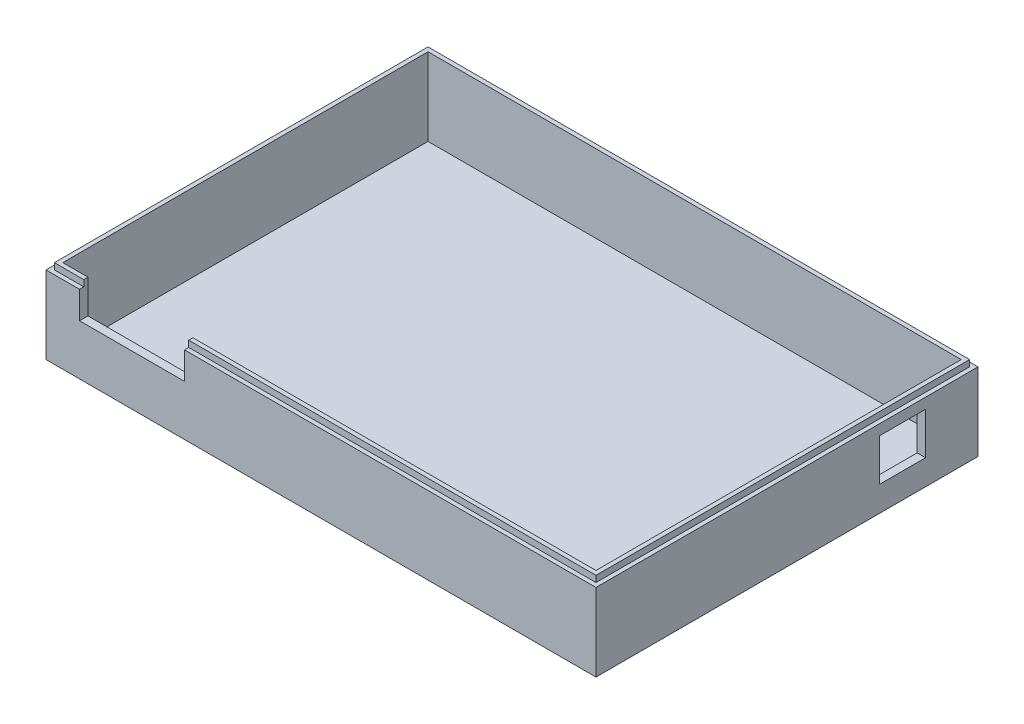
from build123d import *

# Parameters (mm, degrees)
SKETCH1_W           = 127
SKETCH1_H           = 87
BOSS_EXTRUDE1_DEPTH = 1.5
SKETCH3_W           = 131
SKETCH3_H           = 91
SKETCH3_W_2         = 127
SKETCH3_H_2         = 87
BOSS_EXTRUDE2_DEPTH = 20
CUT_EXTRUDE1_REACH  = 115.891
SKETCH4_W           = 25
SKETCH4_H           = 10
CUT_EXTRUDE2_REACH  = 142.112
SKETCH5_W           = 11
SKETCH5_H           = 10
CUT_EXTRUDE3_DEPTH  = 1.5


with BuildPart() as part:
    # Sketch1 → Boss-Extrude1 (new body)
    with BuildSketch(Plane(origin=(0, 0, 0), x_dir=(1, 0, 0), z_dir=(0, 1, 0))):
        Rectangle(SKETCH1_W, SKETCH1_H)
    extrude(amount=BOSS_EXTRUDE1_DEPTH)

    # Sketch3 → Boss-Extrude2 (add)
    with BuildSketch(Plane(origin=(0, 0, 0), x_dir=(1, 0, 0), z_dir=(0, 1, 0))):
        Rectangle(SKETCH3_W, SKETCH3_H)
        Rectangle(SKETCH3_W_2, SKETCH3_H_2, mode=Mode.SUBTRACT)
    extrude(amount=BOSS_EXTRUDE2_DEPTH)

    # Sketch4 → Cut-Extrude1 (cut, up to next)
    with BuildSketch(Plane.XY.offset(45.5), mode=Mode.PRIVATE) as cut_extrude1_sk1:
        with Locations((-45, 17)):
            Rectangle(SKETCH4_W, SKETCH4_H)
    cut_extrude1_tool1 = extrude(cut_extrude1_sk1.sketch, amount=-CUT_EXTRUDE1_REACH, mode=Mode.PRIVATE) & part.part
    add(cut_extrude1_tool1.solids().sort_by_distance((-45, 17, 45.5))[0], mode=Mode.SUBTRACT)

    # Sketch5 → Cut-Extrude2 (cut, up to next)
    with BuildSketch(Plane(origin=(65.5, 0, 0), x_dir=(0, 0, -1), z_dir=(1, 0, 0)), mode=Mode.PRIVATE) as cut_extrude2_sk1:
        with Locations((27.5, 11)):
            Rectangle(SKETCH5_W, SKETCH5_H)
    cut_extrude2_tool1 = extrude(cut_extrude2_sk1.sketch, amount=-CUT_EXTRUDE2_REACH, mode=Mode.PRIVATE) & part.part
    add(cut_extrude2_tool1.solids().sort_by_distance((65.5, 11, -27.5))[0], mode=Mode.SUBTRACT)

    # Sketch6 → Cut-Extrude3 (cut)
    with BuildSketch(Plane(origin=(0, 20, 0), x_dir=(1, 0, 0), z_dir=(0, 1, 0))):
        Polygon((-57.5, -44.5), (-64.5, -44.5), (-64.5, 44.5), (64.5, 44.5), (64.5, -44.5), (-32.5, -44.5), (-32.5, -45.5), (65.5, -45.5), (65.5, 45.5), (-65.5, 45.5), (-65.5, -45.5), (-57.5, -45.5), align=None)
    extrude(amount=-CUT_EXTRUDE3_DEPTH, mode=Mode.SUBTRACT)


solid = part.part
